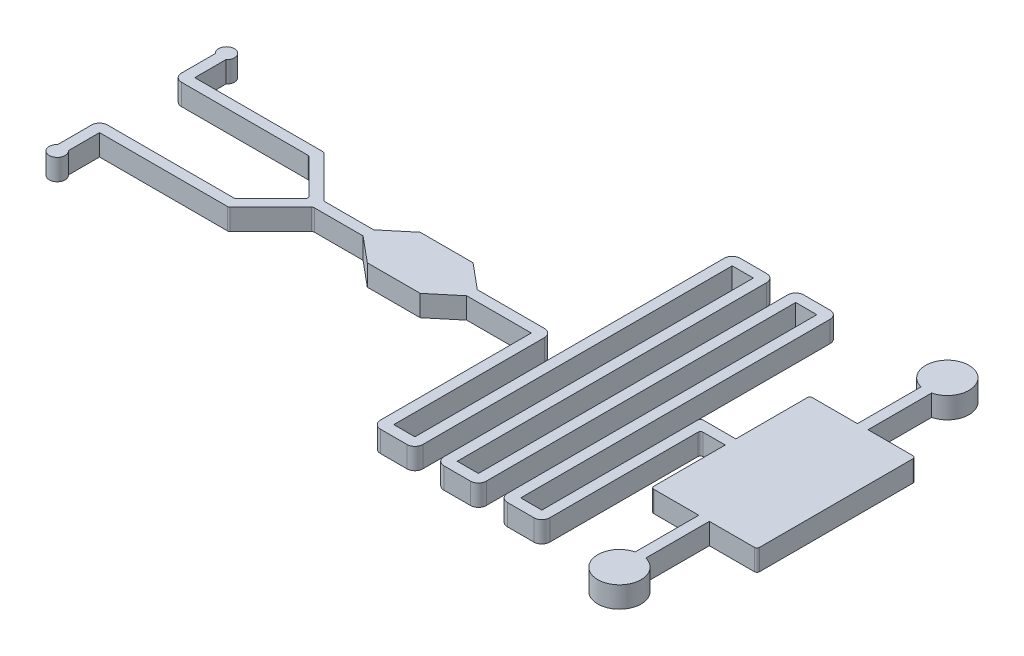
from build123d import *

# Parameters (mm, degrees)
BOSS_EXTRUDE1_DEPTH = 2


with BuildPart() as part:
    # Sketch2 → Boss-Extrude1 (new body)
    with BuildSketch(Plane(origin=(0, 0, 0), x_dir=(1, 0, 0), z_dir=(0, 1, 0))):
        with BuildLine():
            Line((15.163755459, 7.25), (15.163755459, -7.25))
            ThreePointArc((15.163755459, -7.25), (15.090532154, -7.426776695), (14.913755459, -7.5))
            Line((14.913755459, -7.5), (10.663755459, -7.5))
            Line((10.663755459, -7.5), (10.663755459, -13.511910465))
            ThreePointArc((10.663755459, -13.511910465), (10.163755459, -17.55), (9.663755459, -13.511910465))
            Line((9.663755459, -13.511910465), (9.663755459, -7.5))
            Line((9.663755459, -7.5), (5.413755459, -7.5))
            ThreePointArc((5.413755459, -7.5), (5.236978763, -7.426776695), (5.163755459, -7.25))
            Line((5.163755459, -7.25), (5.163755459, -0.5))
            Line((5.163755459, -0.5), (3.075114856, -0.5))
            ThreePointArc((3.075114856, -0.5), (2.898338161, -0.573223305), (2.825114856, -0.75))
            Line((2.825114856, -0.75), (2.825114856, -14.75))
            ThreePointArc((2.825114856, -14.75), (2.605444942, -15.280330086), (2.075114856, -15.5))
            Line((2.075114856, -15.5), (-0.424885144, -15.5))
            ThreePointArc((-0.424885144, -15.5), (-0.95521523, -15.280330086), (-1.174885144, -14.75))
            Line((-1.174885144, -14.75), (-1.174885144, 14.5))
            Line((-1.174885144, 14.5), (-3.174885144, 14.5))
            Line((-3.174885144, 14.5), (-3.174885144, -14.75))
            ThreePointArc((-3.174885144, -14.75), (-3.394555058, -15.280330086), (-3.924885144, -15.5))
            Line((-3.924885144, -15.5), (-6.424885144, -15.5))
            ThreePointArc((-6.424885144, -15.5), (-6.95521523, -15.280330086), (-7.174885144, -14.75))
            Line((-7.174885144, -14.75), (-7.174885144, 14.5))
            Line((-7.174885144, 14.5), (-9.174885144, 14.5))
            Line((-9.174885144, 14.5), (-9.174885144, -14.75))
            ThreePointArc((-9.174885144, -14.75), (-9.394555058, -15.280330086), (-9.924885144, -15.5))
            Line((-9.924885144, -15.5), (-12.424885144, -15.5))
            ThreePointArc((-12.424885144, -15.5), (-12.95521523, -15.280330086), (-13.174885144, -14.75))
            Line((-13.174885144, -14.75), (-13.174885144, -0.5))
            Line((-13.174885144, -0.5), (-19.274885144, -0.5))
            Line((-19.274885144, -0.5), (-21.674885144, -2.5))
            Line((-21.674885144, -2.5), (-26.674885144, -2.5))
            Line((-26.674885144, -2.5), (-29.074885144, -0.5))
            Line((-29.074885144, -0.5), (-33.68175141, -0.5))
            ThreePointArc((-33.68175141, -0.5), (-33.777422268, -0.519030117), (-33.858528105, -0.573223305))
            Line((-33.858528105, -0.573223305), (-37.712081496, -4.426776695))
            ThreePointArc((-37.712081496, -4.426776695), (-37.793187333, -4.480969883), (-37.888858191, -4.5))
            Line((-37.888858191, -4.5), (-46.992411582, -4.5))
            Line((-46.992411582, -4.5), (-49.992411582, -4.5))
            Line((-49.992411582, -4.5), (-49.992411582, -7.440983006))
            ThreePointArc((-49.992411582, -7.440983006), (-50.492411582, -8.75), (-50.992411582, -7.440983006))
            Line((-50.992411582, -7.440983006), (-50.992411582, -4.25))
            ThreePointArc((-50.992411582, -4.25), (-50.772741668, -3.719669914), (-50.242411582, -3.5))
            Line((-50.242411582, -3.5), (-38.303071753, -3.5))
            ThreePointArc((-38.303071753, -3.5), (-38.207400895, -3.480969883), (-38.126295058, -3.426776695))
            Line((-38.126295058, -3.426776695), (-34.876295058, -0.176776695))
            ThreePointArc((-34.876295058, -0.176776695), (-34.803071753, 0), (-34.876295058, 0.176776695))
            Line((-34.876295058, 0.176776695), (-38.126295058, 3.426776695))
            ThreePointArc((-38.126295058, 3.426776695), (-38.207400895, 3.480969883), (-38.303071753, 3.5))
            Line((-38.303071753, 3.5), (-46.242411582, 3.5))
            Line((-46.242411582, 3.5), (-50.242411582, 3.5))
            ThreePointArc((-50.242411582, 3.5), (-50.772741668, 3.719669914), (-50.992411582, 4.25))
            Line((-50.992411582, 4.25), (-50.992411582, 7.440983006))
            ThreePointArc((-50.992411582, 7.440983006), (-50.492411582, 8.75), (-49.992411582, 7.440983006))
            Line((-49.992411582, 7.440983006), (-49.992411582, 4.5))
            Line((-49.992411582, 4.5), (-46.992411582, 4.5))
            Line((-46.992411582, 4.5), (-37.888858191, 4.5))
            ThreePointArc((-37.888858191, 4.5), (-37.793187333, 4.480969883), (-37.712081496, 4.426776695))
            Line((-37.712081496, 4.426776695), (-33.858528105, 0.573223305))
            ThreePointArc((-33.858528105, 0.573223305), (-33.777422268, 0.519030117), (-33.68175141, 0.5))
            Line((-33.68175141, 0.5), (-29.074885144, 0.5))
            Line((-29.074885144, 0.5), (-26.674885144, 2.5))
            Line((-26.674885144, 2.5), (-21.674885144, 2.5))
            Line((-21.674885144, 2.5), (-19.274885144, 0.5))
            Line((-19.274885144, 0.5), (-12.924885144, 0.5))
            ThreePointArc((-12.924885144, 0.5), (-12.394555058, 0.280330086), (-12.174885144, -0.25))
            Line((-12.174885144, -0.25), (-12.174885144, -14.5))
            Line((-12.174885144, -14.5), (-10.174885144, -14.5))
            Line((-10.174885144, -14.5), (-10.174885144, 14.75))
            ThreePointArc((-10.174885144, 14.75), (-9.95521523, 15.280330086), (-9.424885144, 15.5))
            Line((-9.424885144, 15.5), (-6.924885144, 15.5))
            ThreePointArc((-6.924885144, 15.5), (-6.394555058, 15.280330086), (-6.174885144, 14.75))
            Line((-6.174885144, 14.75), (-6.174885144, -14.5))
            Line((-6.174885144, -14.5), (-4.174885144, -14.5))
            Line((-4.174885144, -14.5), (-4.174885144, 14.75))
            ThreePointArc((-4.174885144, 14.75), (-3.95521523, 15.280330086), (-3.424885144, 15.5))
            Line((-3.424885144, 15.5), (-0.924885144, 15.5))
            ThreePointArc((-0.924885144, 15.5), (-0.394555058, 15.280330086), (-0.174885144, 14.75))
            Line((-0.174885144, 14.75), (-0.174885144, -14.5))
            Line((-0.174885144, -14.5), (1.825114856, -14.5))
            Line((1.825114856, -14.5), (1.825114856, 0.25))
            ThreePointArc((1.825114856, 0.25), (1.898338161, 0.426776695), (2.075114856, 0.5))
            Line((2.075114856, 0.5), (5.163755459, 0.5))
            Line((5.163755459, 0.5), (5.163755459, 7.25))
            ThreePointArc((5.163755459, 7.25), (5.236978763, 7.426776695), (5.413755459, 7.5))
            Line((5.413755459, 7.5), (9.663755459, 7.5))
            Line((9.663755459, 7.5), (9.663755459, 13.511910465))
            ThreePointArc((9.663755459, 13.511910465), (10.163755459, 17.55), (10.663755459, 13.511910465))
            Line((10.663755459, 13.511910465), (10.663755459, 7.5))
            Line((10.663755459, 7.5), (14.913755459, 7.5))
            ThreePointArc((14.913755459, 7.5), (15.090532154, 7.426776695), (15.163755459, 7.25))
        make_face()
    extrude(amount=BOSS_EXTRUDE1_DEPTH)


solid = part.part
